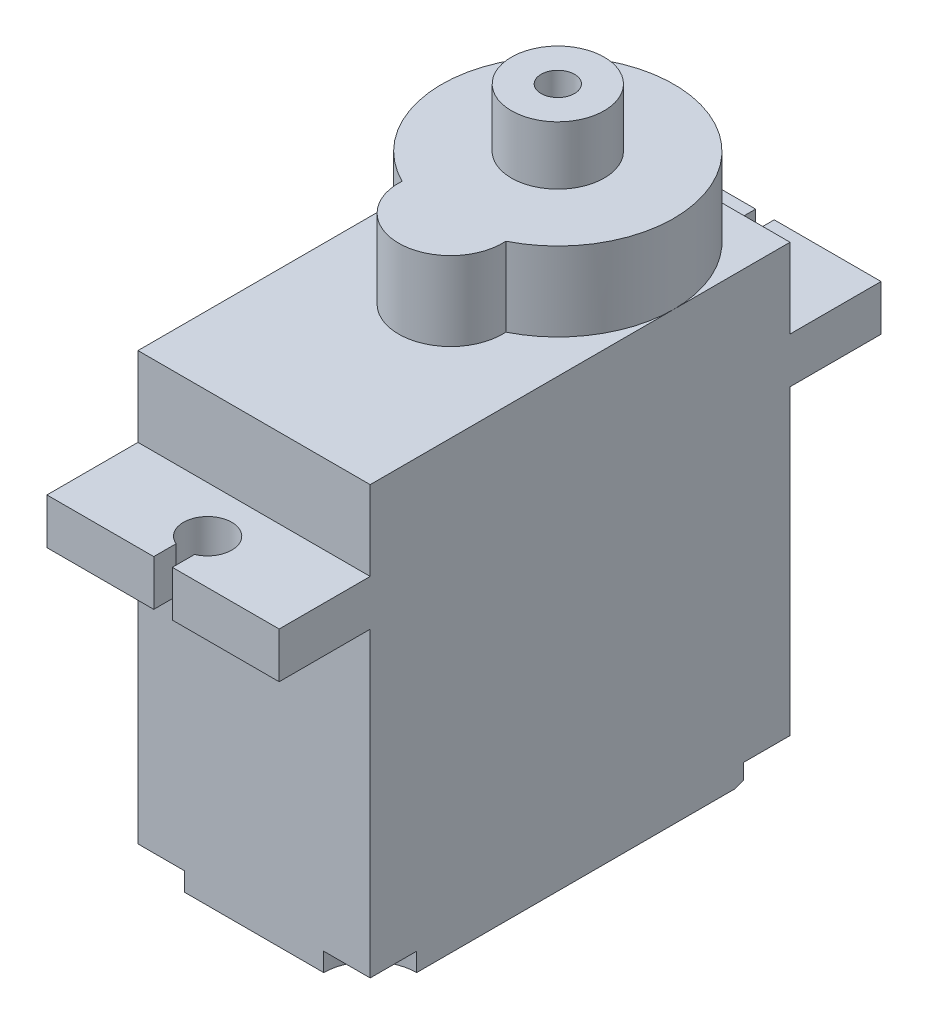
from build123d import *

# Parameters (mm, degrees)
EXTRUDE_1_DEPTH     = 6.25
CUT_EXTRUDE_1_DEPTH = 12.5
EXTRUDE_2_DEPTH     = 4.24
SKETCH_4_R          = 2.5
SKETCH_4_R_2        = 0.9
EXTRUDE_3_DEPTH     = 3.14
SKETCH_5_R          = 2.5
CUT_EXTRUDE_2_DEPTH = 1
CUT_EXTRUDE_3_REACH = 30.418


with BuildPart() as part:
    # 草图1 → 凸台-拉伸1 (new, symmetric)
    with BuildSketch(Plane(origin=(0, 0, 0), x_dir=(0, 0, -1), z_dir=(1, 0, 0))):
        Polygon((-11.3, 4.28), (11.3, 4.28), (11.3, 0), (16.2, 0), (16.2, -2.46), (11.3, -2.46), (11.3, -19.72), (-11.3, -19.72), (-11.3, -2.46), (-16.2, -2.46), (-16.2, 0), (-11.3, 0), align=None)
    extrude(amount=EXTRUDE_1_DEPTH, both=True)

    # 草图2 → 切除-拉伸1 (cut)
    with BuildSketch(Plane(origin=(0, 0, 0), x_dir=(1, 0, 0), z_dir=(0, 1, 0))):
        with BuildLine():
            Line((-0.5, 15), (-0.5, 16.2))
            Line((-0.5, 16.2), (0.5, 16.2))
            Line((0.5, 16.2), (0.5, 15))
            ThreePointArc((0.5, 15), (0, 12.5), (-0.5, 15))
        make_face()
        with BuildLine():
            Line((-0.5, -15), (-0.5, -16.2))
            Line((-0.5, -16.2), (0.5, -16.2))
            Line((0.5, -16.2), (0.5, -15))
            ThreePointArc((0.5, -15), (0, -12.5), (-0.5, -15))
        make_face()
    extrude(amount=-CUT_EXTRUDE_1_DEPTH, mode=Mode.SUBTRACT)

    # 草图3 → 凸台-拉伸2 (add)
    with BuildSketch(Plane(origin=(0, 4.28, 0), x_dir=(1, 0, 0), z_dir=(0, 1, 0))):
        with BuildLine():
            ThreePointArc((2.794246193, -0.540589255), (0, 11.3), (-2.794246193, -0.540589255))
            ThreePointArc((-2.794246193, -0.540589255), (0, -3.52), (2.794246193, -0.540589255))
        make_face()
    extrude(amount=EXTRUDE_2_DEPTH)

    # 草图4 → 凸台-拉伸3 (add)
    with BuildSketch(Plane(origin=(0, 8.52, 0), x_dir=(1, 0, 0), z_dir=(0, 1, 0))):
        with Locations(Location((0, 5.05, 0), (0, 0, 270))):
            Circle(SKETCH_4_R)
        with Locations(Location((0, 5.05, 0), (0, 0, 270))):
            Circle(SKETCH_4_R_2, mode=Mode.SUBTRACT)
    extrude(amount=EXTRUDE_3_DEPTH)

    # 草图5 → 切除-拉伸2 (cut)
    with BuildSketch(Plane.XZ.offset(19.72)):
        with Locations((6.25, 11.3)):
            Circle(SKETCH_5_R)
        with Locations((6.25, -11.3)):
            Circle(SKETCH_5_R)
        with Locations((-6.25, -11.3)):
            Circle(SKETCH_5_R)
        with Locations((-6.25, 11.3)):
            Circle(SKETCH_5_R)
    extrude(amount=-CUT_EXTRUDE_2_DEPTH, mode=Mode.SUBTRACT)

    # 切除-拉伸3: up to this face of the body (flat: up to its plane)
    cut_extrude_3_end = Plane(part.part.faces().sort_by_distance((6.25, -7.338953034, 0))[0])
    # 草图6 → 切除-拉伸3 (cut, up to the picked face)
    with BuildSketch(Plane.ZY.offset(6.25), mode=Mode.PRIVATE) as cut_extrude_3_sk1:
        Polygon((-11.3, -18.72), (-11.3, -19.72), (-8.3, -19.72), align=None)
    cut_extrude_3_tool1 = split(extrude(cut_extrude_3_sk1.sketch, amount=-CUT_EXTRUDE_3_REACH, mode=Mode.PRIVATE), bisect_by=cut_extrude_3_end, keep=Keep.BOTH, mode=Mode.PRIVATE)
    add(cut_extrude_3_tool1.solids().sort_by(Axis((-6.25, -19.386667, -10.3), (1, 0, 0)))[0], mode=Mode.SUBTRACT)


solid = part.part
